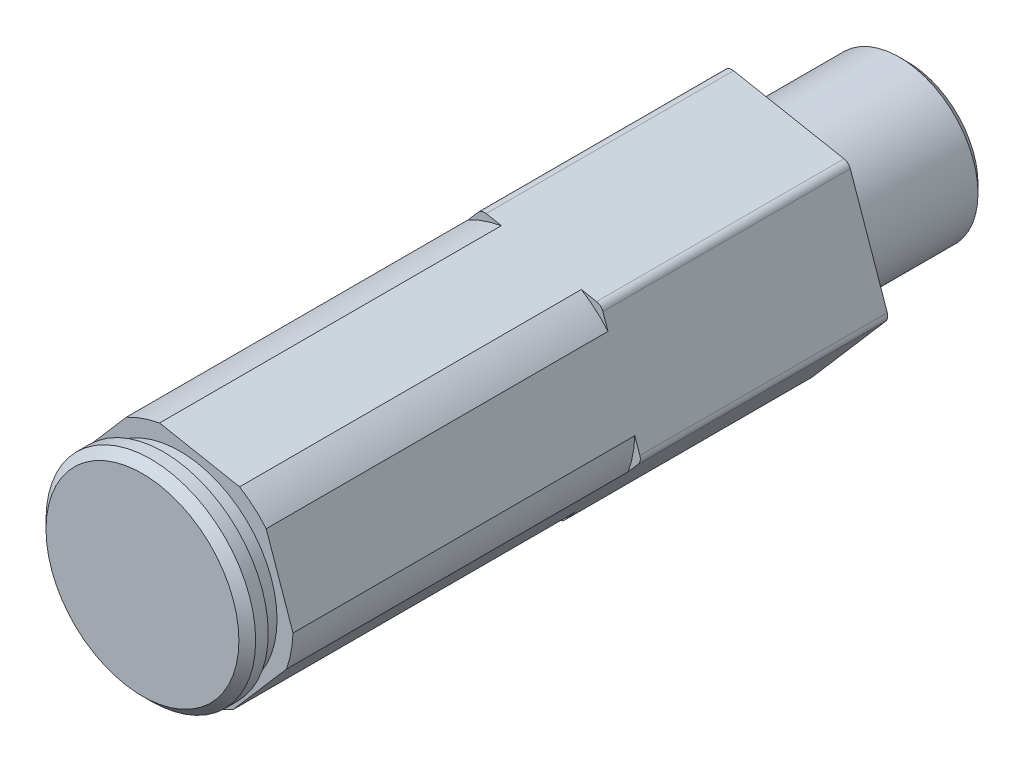
from build123d import *

# Parameters (mm, degrees)
SKETCH3_OUTSIDE_W               = 25.774
SKETCH3_OUTSIDE_H               = 25.774
CUT_EXTRUDE1_DEPTH              = 48.359986768
F_1_4_0_25_DIAMETER_HOLE1_D     = 6.35
F_1_4_0_25_DIAMETER_HOLE1_DEPTH = 8.7376
F_1_4_0_25_DIAMETER_HOLE1_TIP   = 1.907732465
CHAMFER1_SIZE                   = 0.508
BOSS_EXTRUDE1_START             = -14.986
SKETCH7_R                       = 3.175
BOSS_EXTRUDE1_DEPTH             = 14.986
FILLET1_R                       = 0.508


with BuildPart() as part:
    # Sketch2 → Revolve1 (revolve)
    with BuildSketch(Plane(origin=(0, 0, 0), x_dir=(0, 0, -1), z_dir=(1, 0, 0)), mode=Mode.PRIVATE) as revolve1_sk:
        Polygon((-23.1775, 0), (23.1775, 0), (23.1775, 4.7625), (22.6695, 4.7625), (14.7701, 4.7625), (14.7701, 6.862299966), (-20.9169, 6.862299966), (-20.9169, 5.8928), (-21.9075, 5.8928), (-21.9075, 6.35), (-23.1775, 6.35), align=None)
    revolve(revolve1_sk.sketch.rotate(Axis((0, 0, 23.1775), (0, 0, -1)), 90), axis=Axis((0, 0, 23.1775), (0, 0, -1)))

    # Sketch3 outside → Cut-Extrude1 (cut, through all)
    with BuildSketch(Plane.XY.offset(23.1775)):
        Rectangle(SKETCH3_OUTSIDE_W, SKETCH3_OUTSIDE_H)
        Polygon((7.26292966, -1.38571412), (4.83152846, 5.597024532), (-2.4314012, 6.982738652), (-7.26292966, 1.38571412), (-4.83152846, -5.597024532), (2.4314012, -6.982738652), align=None, mode=Mode.SUBTRACT)
    extrude(amount=-CUT_EXTRUDE1_DEPTH, mode=Mode.SUBTRACT)

    # 1/4 (0.25) Diameter Hole1
    with Locations(Plane(origin=(0, 0, -23.1775), x_dir=(-1, 0, 0), z_dir=(0, 0, -1))):
        with Locations((0, 0)):
            Hole(F_1_4_0_25_DIAMETER_HOLE1_D / 2, depth=F_1_4_0_25_DIAMETER_HOLE1_DEPTH)
            with Locations((0, 0, -(F_1_4_0_25_DIAMETER_HOLE1_DEPTH + F_1_4_0_25_DIAMETER_HOLE1_TIP / 2))):  # 118° drill point
                Cone(0, F_1_4_0_25_DIAMETER_HOLE1_D / 2, F_1_4_0_25_DIAMETER_HOLE1_TIP, mode=Mode.SUBTRACT)

    # Chamfer1
    chamfer1_edges = [part.edges().sort_by_distance(p)[0] for p in [
        (-4.7625, 0, -23.1775),
        (-6.35, 0, 23.1775),
    ]]
    chamfer(chamfer1_edges, length=CHAMFER1_SIZE)

    # Sketch7 → Boss-Extrude1 (add)
    with BuildSketch(Plane(origin=(0, 0, -14.7701), x_dir=(-1, 0, 0), z_dir=(0, 0, -1)).offset(BOSS_EXTRUDE1_START)):
        Polygon((-4.83152846, 5.597024532), (-7.26292966, -1.38571412), (-2.4314012, -6.982738652), (4.83152846, -5.597024532), (7.26292966, 1.38571412), (2.4314012, 6.982738652), align=None)
        Circle(SKETCH7_R, mode=Mode.SUBTRACT)
    extrude(amount=BOSS_EXTRUDE1_DEPTH)

    # Fillet1
    fillet1_edges = [part.edges().sort_by_distance(p)[0] for p in [
        (2.4314012, -6.982738652, -7.2771),
        (-4.83152846, -5.597024532, -7.2771),
        (-7.26292966, 1.38571412, -7.2771),
        (-2.4314012, 6.982738652, -7.2771),
        (7.26292966, -1.38571412, -7.2771),
        (4.83152846, 5.597024532, -7.2771),
    ]]
    fillet(fillet1_edges, radius=FILLET1_R)


solid = part.part
